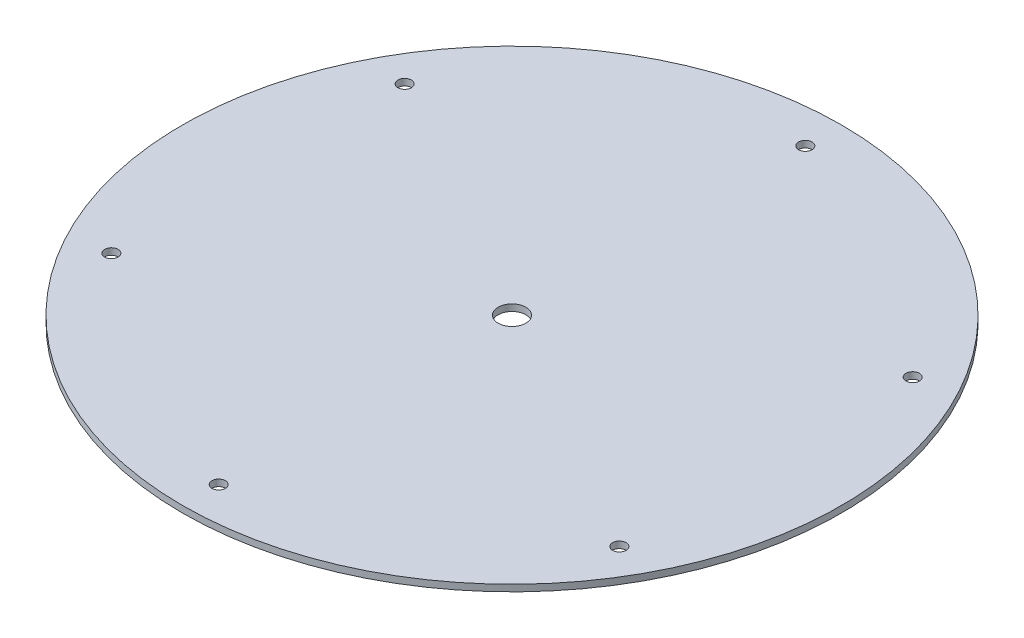
from build123d import *

# Parameters (mm, degrees)
SKETCH1_R           = 250
SKETCH1_R_2         = 5.1
SKETCH1_R_3         = 10.5
BOSS_EXTRUDE1_DEPTH = 2.5


with BuildPart() as part:
    # Sketch1 → Boss-Extrude1 (new, symmetric)
    with BuildSketch(Plane(origin=(0, 0, 0), x_dir=(1, 0, 0), z_dir=(0, 1, 0))):
        with Locations(Location((0, 0, 0), (0, 0, 270))):
            Circle(SKETCH1_R)
        with Locations(Location((0, 222.5, 0), (0, 0, 270))):
            Circle(SKETCH1_R_2, mode=Mode.SUBTRACT)
        with Locations(Location((192.690652342, 111.25, 0), (0, 0, 270))):
            Circle(SKETCH1_R_2, mode=Mode.SUBTRACT)
        with Locations(Location((192.690652342, -111.25, 0), (0, 0, 270))):
            Circle(SKETCH1_R_2, mode=Mode.SUBTRACT)
        with Locations(Location((0, -222.5, 0), (0, 0, 270))):
            Circle(SKETCH1_R_2, mode=Mode.SUBTRACT)
        with Locations(Location((-192.690652342, -111.25, 0), (0, 0, 270))):
            Circle(SKETCH1_R_2, mode=Mode.SUBTRACT)
        with Locations(Location((-192.690652342, 111.25, 0), (0, 0, 270))):
            Circle(SKETCH1_R_2, mode=Mode.SUBTRACT)
        with Locations(Location((0, 0, 0), (0, 0, 270))):
            Circle(SKETCH1_R_3, mode=Mode.SUBTRACT)
    extrude(amount=BOSS_EXTRUDE1_DEPTH, both=True)


solid = part.part
